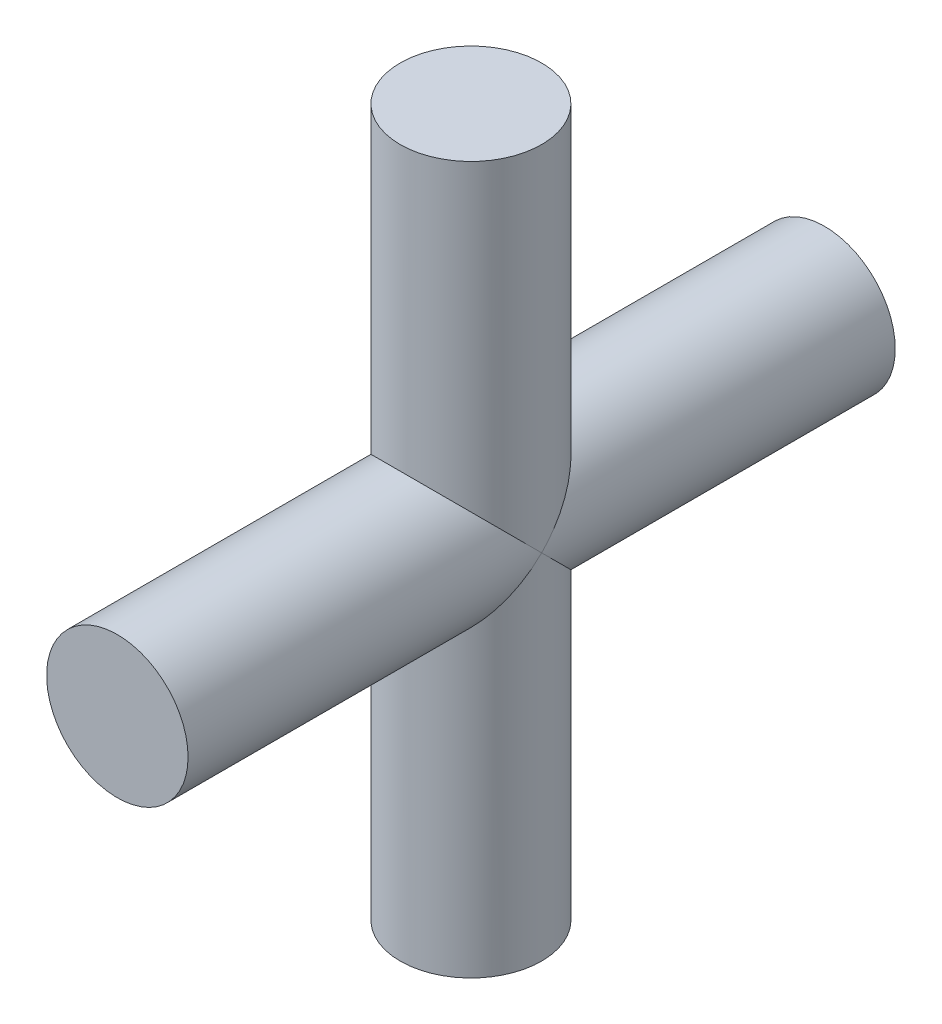
from build123d import *

# Parameters (mm, degrees)
SKETCH1_R                = 5
BOSS_EXTRUDE1_DEPTH      = 50
BOSS_EXTRUDE2_DEPTH      = 25
BOSS_EXTRUDE2_DEPTH_BACK = 25
SKETCH2_R                = 5


with BuildPart() as part:
    # Sketch1 → Boss-Extrude1 (new body)
    with BuildSketch(Plane.XY):
        Circle(SKETCH1_R)
    extrude(amount=BOSS_EXTRUDE1_DEPTH)

    # Sketch2 → Boss-Extrude2 (add, two sides: drawn at the far end of the back side and taken through both)
    with BuildSketch(Plane(origin=(0, 0, 0), x_dir=(1, 0, 0), z_dir=(0, 1, 0)).offset(-BOSS_EXTRUDE2_DEPTH_BACK)):
        with Locations((0, -25)):
            Circle(SKETCH2_R)
    extrude(amount=BOSS_EXTRUDE2_DEPTH + BOSS_EXTRUDE2_DEPTH_BACK)


solid = part.part
